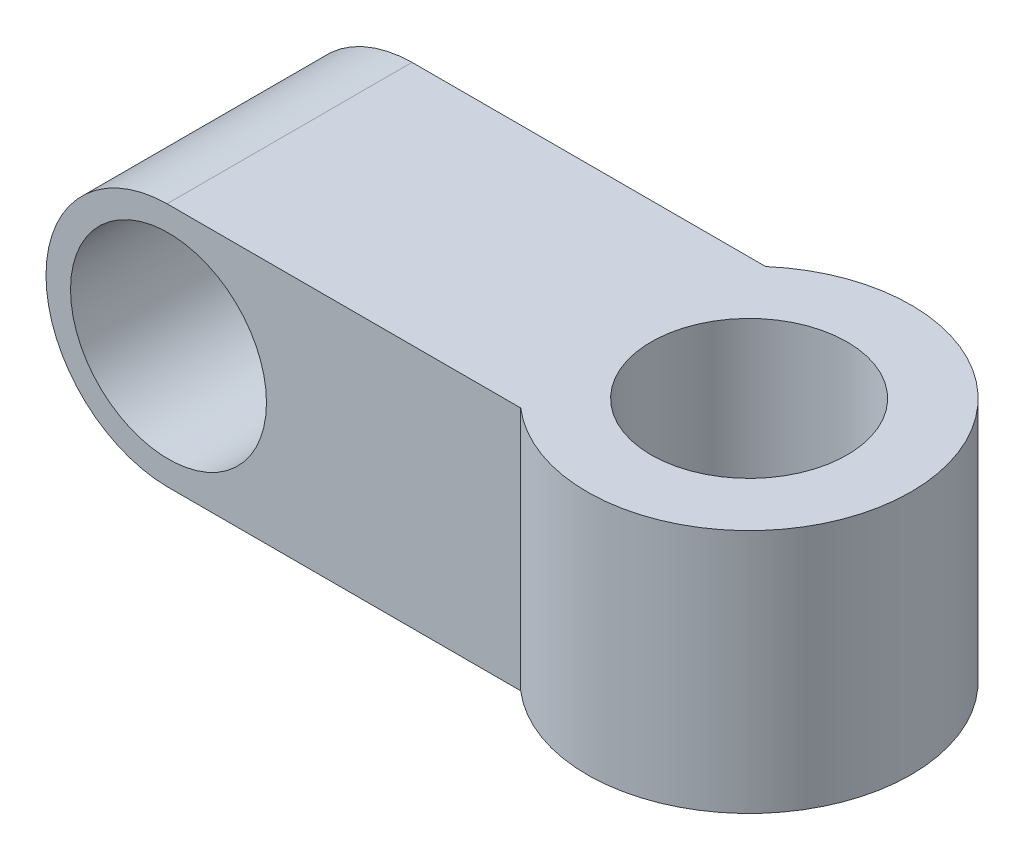
from build123d import *

# Parameters (mm, degrees)
SKETCH_1_R          = 3.305414419
SKETCH_1_R_2        = 2
EXTRUDE_1_DEPTH     = 5
EXTRUDE_2_DEPTH     = 2.5
CUT_EXTRUDE_START   = -5
SKETCH_5_R          = 2
CUT_EXTRUDE_1_DEPTH = 5
SKETCH_6_R          = 2
CUT_EXTRUDE_2_DEPTH = 15.112515325


with BuildPart() as part:
    # 草图1 → 凸台-拉伸1 (new body)
    with BuildSketch(Plane(origin=(0, 0, 0), x_dir=(1, 0, 0), z_dir=(0, 1, 0))):
        with Locations(Location((0, 0, 0), (0, 0, 270))):
            Circle(SKETCH_1_R)
        with Locations(Location((0, 0, 0), (0, 0, 270))):
            Circle(SKETCH_1_R_2, mode=Mode.SUBTRACT)
    extrude(amount=EXTRUDE_1_DEPTH)

    # 草图4 → 凸台-拉伸2 (add, symmetric)
    with BuildSketch(Plane.XY):
        with BuildLine():
            Line((0, 0), (0, 5))
            Line((0, 5), (-9.380296623, 5))
            ThreePointArc((-9.380296623, 5), (-11.851592814, 2.5), (-9.380296623, 0))
            Line((-9.380296623, 0), (0, 0))
        make_face()
    extrude(amount=EXTRUDE_2_DEPTH, both=True)

    # 草图5 → 切除-拉伸1 (cut)
    with BuildSketch(Plane(origin=(0, 5, 0), x_dir=(1, 0, 0), z_dir=(0, 1, 0)).offset(CUT_EXTRUDE_START)):
        with Locations(Location((0, 0, 0), (0, 0, 270))):
            Circle(SKETCH_5_R)
    extrude(amount=CUT_EXTRUDE_1_DEPTH, mode=Mode.SUBTRACT)

    # 草图6 → 切除-拉伸2 (cut, through all)
    with BuildSketch(Plane.XY.offset(2.5)):
        with Locations((-9.351426118, 2.5)):
            Circle(SKETCH_6_R)
    extrude(amount=-CUT_EXTRUDE_2_DEPTH, mode=Mode.SUBTRACT)


solid = part.part
